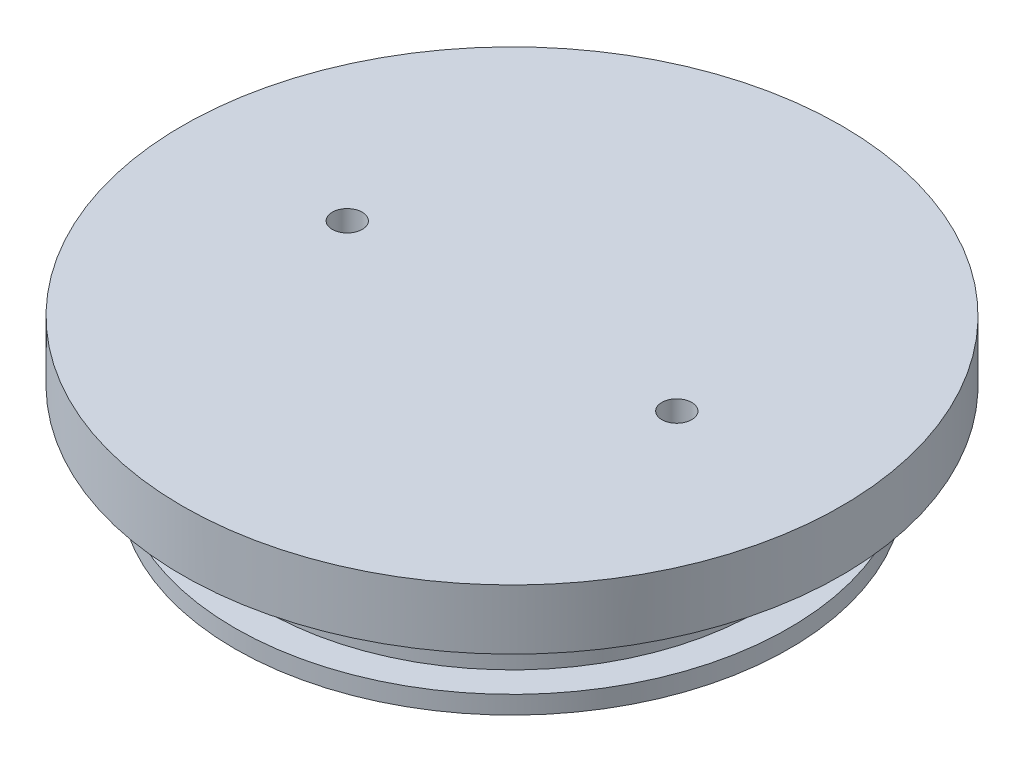
from build123d import *

# Parameters (mm, degrees)
SKETCH_1_R           = 11
EXTRUDE_1_DEPTH      = 9
SKETCH_2_R           = 0.5
CUT_EXTRUDE_1_DEPTH  = 18.972200756
SKETCH_3_R           = 16.549134696
SKETCH_3_R_2         = 9.25
CUT_EXTRUDE_2_DEPTH  = 7
SKETCH_4_W           = 2
SKETCH_4_H           = 1.7
SKETCH_5_W           = 5
SKETCH_5_H           = 6
CUT_EXTRUDE_3_DEPTH  = 7
SKETCH_8_R           = 1.25
CUT_EXTRUDE_6_DEPTH  = 1.5
SKETCH_9_W           = 7
SKETCH_9_H           = 8
SKETCH_9_W_2         = 5
SKETCH_9_H_2         = 6
CUT_EXTRUDE_7_DEPTH  = 2
CHAMFER_1_SIZE       = 0.5
SKETCH_10_R          = 16.70563627
CUT_EXTRUDE_8_DEPTH  = 4
SKETCH_11_R          = 2
CUT_EXTRUDE_9_DEPTH  = 3
SKETCH_12_R          = 1.25
CUT_EXTRUDE_10_DEPTH = 3


with BuildPart() as part:
    # 草图1 → 凸台-拉伸1 (new body)
    with BuildSketch(Plane(origin=(0, 0, 0), x_dir=(1, 0, 0), z_dir=(0, 1, 0))):
        with Locations(Location((0, 0, 0), (0, 0, 270))):
            Circle(SKETCH_1_R)
    extrude(amount=EXTRUDE_1_DEPTH)

    # 草图2 → 切除-拉伸1 (cut, through all)
    with BuildSketch(Plane(origin=(0, 9, 0), x_dir=(1, 0, 0), z_dir=(0, 1, 0))):
        with Locations(Location((-5.5, 0, 0), (0, 0, 270))):
            Circle(SKETCH_2_R)
        with Locations(Location((5.5, 0, 0), (0, 0, 270))):
            Circle(SKETCH_2_R)
    extrude(amount=-CUT_EXTRUDE_1_DEPTH, mode=Mode.SUBTRACT)

    # 草图3 → 切除-拉伸2 (cut)
    with BuildSketch(Plane.XZ):
        Circle(SKETCH_3_R)
        with Locations(Location((0, 0, 0), (0, 0, 270))):
            Circle(SKETCH_3_R_2, mode=Mode.SUBTRACT)
    extrude(amount=-CUT_EXTRUDE_2_DEPTH, mode=Mode.SUBTRACT)

    # 草图4 → 切除-旋转1 (revolve, cut)
    with BuildSketch(Plane.XY, mode=Mode.PRIVATE) as cut_revolve_1_sk:
        with Locations((-9.25, 5.45)):
            Rectangle(SKETCH_4_W, SKETCH_4_H)
        with Locations((-9.25, 2.35)):
            Rectangle(SKETCH_4_W, SKETCH_4_H)
    revolve(cut_revolve_1_sk.sketch.rotate(Axis((0, 0, 0), (0, 1, 0)), 270), axis=Axis((0, 0, 0), (0, 1, 0)), mode=Mode.SUBTRACT)

    # 草图5 → 切除-拉伸3 (cut)
    with BuildSketch(Plane.XZ):
        Rectangle(SKETCH_5_W, SKETCH_5_H)
    extrude(amount=-CUT_EXTRUDE_3_DEPTH, mode=Mode.SUBTRACT)

    # 草图8 → 切除-拉伸6 (cut)
    with BuildSketch(Plane.XZ):
        with Locations(Location((-5.5, 0, 0), (0, 0, 270))):
            Circle(SKETCH_8_R)
        with Locations(Location((5.5, 0, 0), (0, 0, 270))):
            Circle(SKETCH_8_R)
    extrude(amount=-CUT_EXTRUDE_6_DEPTH, mode=Mode.SUBTRACT)

    # 草图9 → 切除-拉伸7 (cut)
    with BuildSketch(Plane.XZ):
        Rectangle(SKETCH_9_W, SKETCH_9_H)
        Rectangle(SKETCH_9_W_2, SKETCH_9_H_2, mode=Mode.SUBTRACT)
    extrude(amount=-CUT_EXTRUDE_7_DEPTH, mode=Mode.SUBTRACT)

    # 倒角1
    chamfer_1_edges = [part.edges().sort_by_distance(p)[0] for p in [
        (0, 0, 9.25),
    ]]
    chamfer(chamfer_1_edges, length=CHAMFER_1_SIZE)

    # 草图10 → 切除-拉伸8 (cut)
    with BuildSketch(Plane(origin=(0, 0, 0), x_dir=(-1, 0, 0), z_dir=(0, -1, 0))):
        Circle(SKETCH_10_R)
    extrude(amount=-CUT_EXTRUDE_8_DEPTH, mode=Mode.SUBTRACT)

    # 草图11 → 切除-拉伸9 (cut)
    with BuildSketch(Plane.XZ.offset(-4)):
        with Locations(Location((-5.5, 0, 0), (0, 0, 270))):
            Circle(SKETCH_11_R)
        with Locations(Location((5.5, 0, 0), (0, 0, 270))):
            Circle(SKETCH_11_R)
    extrude(amount=-CUT_EXTRUDE_9_DEPTH, mode=Mode.SUBTRACT)

    # 草图12 → 切除-拉伸10 (cut)
    with BuildSketch(Plane.XZ.offset(-4)):
        with Locations(Location((-2.75, 4.765, 0), (0, 0, 270))):
            Circle(SKETCH_12_R)
        with Locations(Location((2.75, 4.765, 0), (0, 0, 270))):
            Circle(SKETCH_12_R)
        with Locations(Location((2.75, -4.765, 0), (0, 0, 270))):
            Circle(SKETCH_12_R)
        with Locations(Location((-2.75, -4.765, 0), (0, 0, 270))):
            Circle(SKETCH_12_R)
    extrude(amount=-CUT_EXTRUDE_10_DEPTH, mode=Mode.SUBTRACT)


solid = part.part
